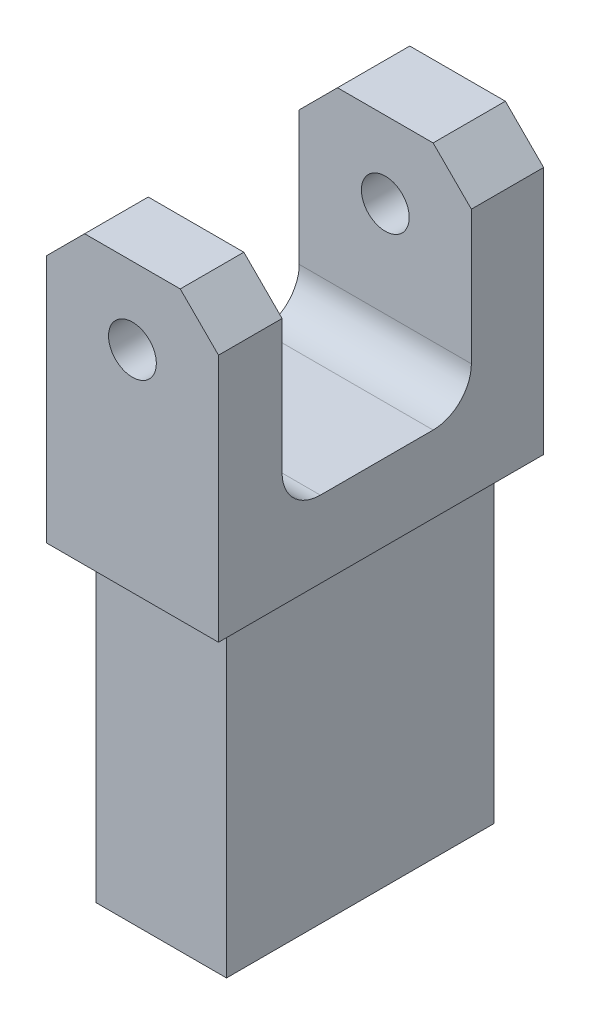
from build123d import *

# Parameters (mm, degrees)
EXTRUDE_START       = -18
SKETCH_1_W          = 13.648314944
SKETCH_1_H          = 27.972083639
EXTRUDE_1_DEPTH     = 33
SKETCH_3_W          = 18
SKETCH_3_H          = 34
EXTRUDE_2_DEPTH     = 30
SKETCH_4_W          = 20.982707523
SKETCH_4_H          = 19.792714352
CUT_EXTRUDE_1_DEPTH = 22
FILLET_1_R          = 4
SKETCH_5_R          = 2.5
CUT_EXTRUDE_2_DEPTH = 60.029924153
CHAMFER_1_SIZE      = 4


with BuildPart() as part:
    # Эскиз1 → Вытянуть1 (new body)
    with BuildSketch(Plane(origin=(0, 0, 0), x_dir=(1, 0, 0), z_dir=(0, 1, 0)).offset(EXTRUDE_START)):
        with Locations((8.422168222, -36.610171765)):
            Rectangle(SKETCH_1_W, SKETCH_1_H)
    extrude(amount=EXTRUDE_1_DEPTH)

    # Эскиз3 → Вытянуть2 (add)
    with BuildSketch(Plane(origin=(0, 15, 0), x_dir=(1, 0, 0), z_dir=(0, 1, 0))):
        with Locations((8.422168222, -36.610171766)):
            Rectangle(SKETCH_3_W, SKETCH_3_H)
    extrude(amount=EXTRUDE_2_DEPTH)

    # Эскиз4 → Вырез-Вытянуть1 (cut)
    with BuildSketch(Plane(origin=(0, 45, 0), x_dir=(1, 0, 0), z_dir=(0, 1, 0))):
        with Locations((9.143949352, -37.062876014)):
            Rectangle(SKETCH_4_W, SKETCH_4_H)
    extrude(amount=-CUT_EXTRUDE_1_DEPTH, mode=Mode.SUBTRACT)

    # Скругление1
    fillet_1_edges = [part.edges().sort_by_distance(p)[0] for p in [
        (8.422168222, 23, 27.166518838),
        (8.422168222, 23, 46.95923319),
    ]]
    fillet(fillet_1_edges, radius=FILLET_1_R)

    # Эскиз5 → Вырез-Вытянуть2 (cut, through all)
    with BuildSketch(Plane.XY.offset(53.610171766)):
        with Locations((8.422168222, 37)):
            Circle(SKETCH_5_R)
    extrude(amount=-CUT_EXTRUDE_2_DEPTH, mode=Mode.SUBTRACT)

    # Фаска1
    chamfer_1_edges = [part.edges().sort_by_distance(p)[0] for p in [
        (-0.577831778, 45, 23.388345302),
        (17.422168222, 45, 50.284702478),
        (-0.577831778, 45, 50.284702478),
        (17.422168222, 45, 23.388345302),
    ]]
    chamfer(chamfer_1_edges, length=CHAMFER_1_SIZE)


solid = part.part
